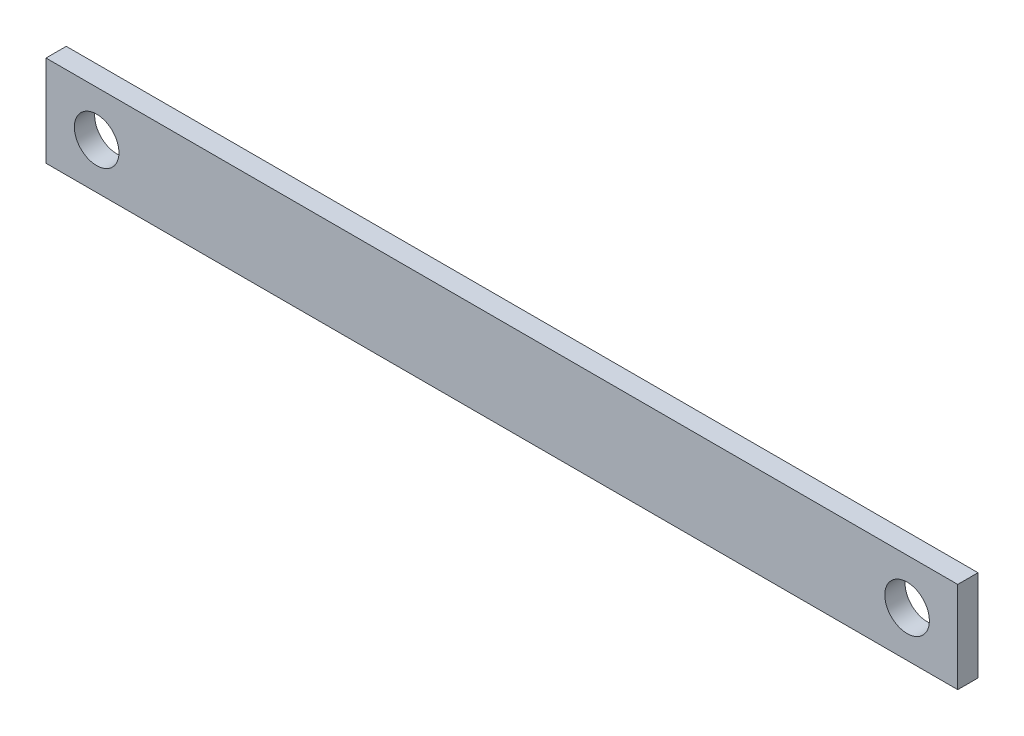
from build123d import *

# Parameters (mm, degrees)
SKETCH1_R           = 2.794
BOSS_EXTRUDE1_DEPTH = 2.54


with BuildPart() as part:
    # Sketch1 → Boss-Extrude1 (new body)
    with BuildSketch(Plane.XY):
        Polygon((-57.15, 2.54), (-57.15, -2.54), (-57.15, -5.715), (57.15, -5.715), (57.15, -2.54), (57.15, 2.54), (57.15, 5.715), (-57.15, 5.715), align=None)
        with Locations((50.8, 0)):
            Circle(SKETCH1_R, mode=Mode.SUBTRACT)
        with Locations((-50.8, 0)):
            Circle(SKETCH1_R, mode=Mode.SUBTRACT)
    extrude(amount=BOSS_EXTRUDE1_DEPTH)


solid = part.part
